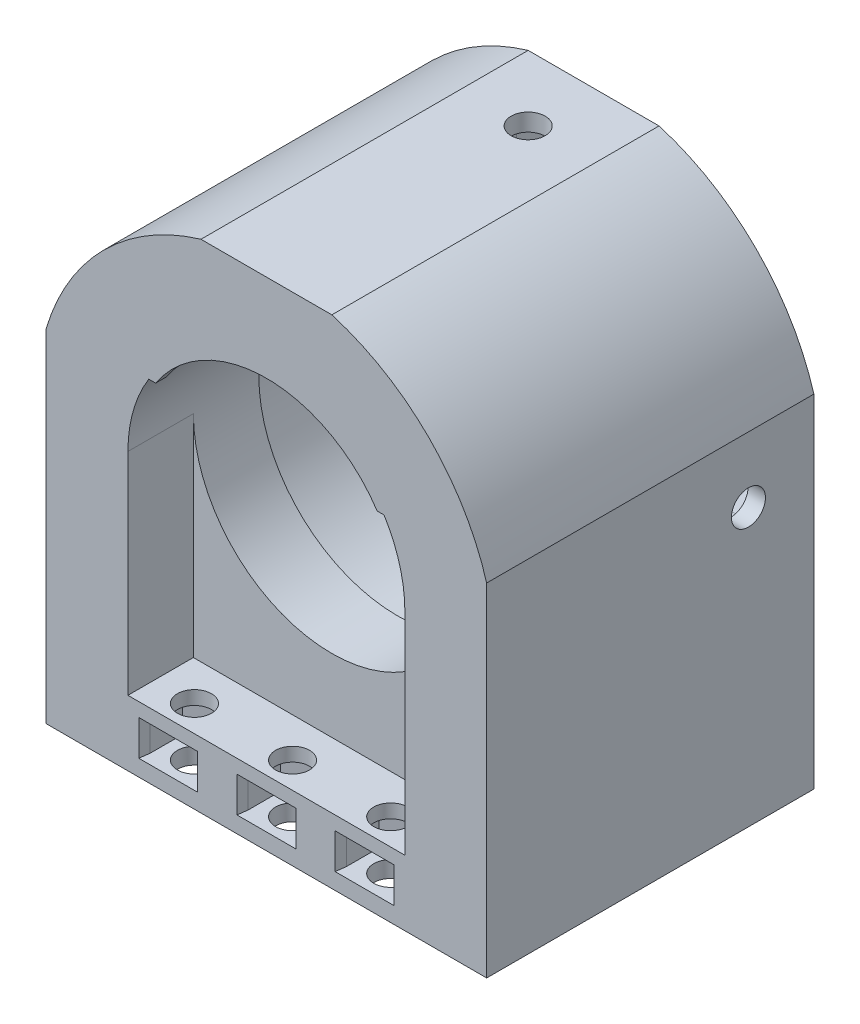
from build123d import *

# Parameters (mm, degrees)
BOSS_EXTRUDE2_DEPTH = 12.7
CUT_EXTRUDE1_DEPTH  = 12.7
CUT_EXTRUDE2_START  = -12.7
CUT_EXTRUDE2_DEPTH  = 12.7
BOSS_EXTRUDE3_REACH = 106.45
SKETCH9_R           = 3.3020000000000005
SKETCH9_R_2         = 3.3019999999999987
CUT_EXTRUDE3_DEPTH  = 93.09259864397356
CUT_EXTRUDE4_START  = -3.175
CUT_EXTRUDE4_DEPTH  = 6.8580000000000005
BOSS_EXTRUDE6_DEPTH = 38.1
SKETCH12_W          = 25.4
SKETCH12_H          = 6.350000000000001
BOSS_EXTRUDE4_DEPTH = 25.4
CUT_EXTRUDE5_START  = 39.370000000000005
CUT_EXTRUDE5_DEPTH  = 6.8580000000000005
SKETCH13_R          = 3.302000000000001
CUT_EXTRUDE6_DEPTH  = 93.09259864397356
CIRPATTERN1_COUNT   = 4
BOSS_EXTRUDE5_START = 38.1
BOSS_EXTRUDE5_DEPTH = 38.1
SKETCH16_W          = 3.1749999999999687
SKETCH16_H          = 40.98999999999984
SKETCH16_W_2        = 3.1750000000001393
SKETCH16_H_2        = 40.990000000000464
BOSS_EXTRUDE7_DEPTH = 63.5
BOSS_EXTRUDE9_START = -63.5
BOSS_EXTRUDE9_DEPTH = 63.5


with BuildPart() as part:
    # Sketch2 → Revolve1 (revolve)
    with BuildSketch(Plane(origin=(0, 0, 0), x_dir=(1, 0, 0), z_dir=(0, 1, 0))):
        Polygon((25.75, 0), (25.75, 2.14), (26.874999999999996, 5.319999999999995), (26.874999999999993, 25.400000000000006), (39.574999999999996, 25.400000000000002), (39.574999999999974, 5.62e-15), align=None)
    revolve(axis=Axis((0, 0, 0), (0, 0, -1)))

    # Sketch3 → Boss-Extrude2 (add)
    with BuildSketch(Plane.XY):
        Polygon((26.87499999999997, 0), (39.574999999999974, 0), (39.57499999999997, -53.690000000000005), (-39.57499999999997, -53.690000000000005), (-39.574999999999974, 0), (-26.874999999999975, 0), (-26.874999999999968, -40.99), (26.874999999999975, -40.99), align=None)
    extrude(amount=-BOSS_EXTRUDE2_DEPTH)

    # Sketch5 → Cut-Extrude1 (cut)
    with BuildSketch(Plane.XY):
        Polygon((26.874999999999975, -40.99), (-26.874999999999968, -40.99000000000001), (-26.874999999999968, -6.94e-15), (26.874999999999975, -7.8e-16), align=None)
    extrude(amount=-CUT_EXTRUDE1_DEPTH, mode=Mode.SUBTRACT)

    # Sketch6 → Cut-Extrude2 (cut)
    with BuildSketch(Plane.XY.offset(CUT_EXTRUDE2_START)):
        with BuildLine():
            Line((-22.832761550018414, 14.174999999999976), (22.832761550018414, 14.174999999999976))
            ThreePointArc((22.832761550018414, 14.174999999999976), (-4.94e-15, -26.874999999999975), (-22.832761550018414, 14.174999999999976))
        make_face()
    extrude(amount=CUT_EXTRUDE2_DEPTH, mode=Mode.SUBTRACT)

    # Sketch7 → Boss-Extrude3 (add, up to next)
    with BuildSketch(Plane.XZ.offset(53.690000000000005), mode=Mode.PRIVATE) as boss_extrude3_sk1:
        Polygon((39.57499999999997, -12.7), (-39.57499999999997, -12.70000000000001), (-39.57499999999997, -25.40000000000001), (39.57499999999997, -25.4), align=None)
    boss_extrude3_tool1 = extrude(boss_extrude3_sk1.sketch, amount=-BOSS_EXTRUDE3_REACH, mode=Mode.PRIVATE) - part.part
    add(boss_extrude3_tool1.solids().sort_by_distance((0, -53.69, -19.05))[0])

    # Sketch8 → Revolve2 (revolve)
    with BuildSketch(Plane(origin=(0, 0, 0), x_dir=(1, 0, 0), z_dir=(0, 1, 0)), mode=Mode.PRIVATE) as revolve2_sk:
        Polygon((-39.574999999999996, 25.400000000000002), (-39.574999999999974, 63.5), (-29.844999999999995, 63.5), (-29.844999999999995, 25.400000000000006), align=None)
    revolve(revolve2_sk.sketch.rotate(Axis((0, 0, -2.42e-15), (0, 0, -1)), 180), axis=Axis((0, 0, -2.42e-15), (0, 0, -1)))

    # Sketch9 → Cut-Extrude3 (cut, through all)
    with BuildSketch(Plane(origin=(0, 0, 0), x_dir=(1, 0, 0), z_dir=(0, 1, 0))):
        with Locations(Location((0, 5.08, 0), (0, 0, 270))):
            Circle(SKETCH9_R)
        with Locations(Location((19.05, 5.080000000000001, 0), (0, 0, 270))):
            Circle(SKETCH9_R_2)
        with Locations(Location((-19.05, 5.08, 0), (0, 0, 270))):
            Circle(SKETCH9_R_2)
    extrude(amount=-CUT_EXTRUDE3_DEPTH, mode=Mode.SUBTRACT)

    # Sketch10 → Cut-Extrude4 (cut)
    with BuildSketch(Plane(origin=(0, -53.690000000000005, 0), x_dir=(-1, 0, 0), z_dir=(0, -1, 0)).offset(CUT_EXTRUDE4_START)):
        Polygon((-24.511, 1.927090179955452), (-24.765, -8.7e-16), (-13.334999999999999, -8.7e-16), (-13.589, 1.927090179955445), (-13.589, 8.232909820044544), (-19.050000000000004, 11.385819640089089), (-24.511, 8.232909820044545), align=None)
        Polygon((1.88e-15, 11.385819640089093), (-5.460999999999999, 8.232909820044547), (-5.461, 1.9270901799554545), (-5.715, 0), (5.715, 0), (5.4609999999999985, 1.9270901799554514), (5.4609999999999985, 8.232909820044547), align=None)
        Polygon((19.049999999999997, 11.385819640089094), (13.589, 8.23290982004455), (13.589, 1.9270901799554547), (13.335, 8.7e-16), (24.765, 8.7e-16), (24.511000000000003, 1.9270901799554534), (24.511, 8.232909820044547), align=None)
    extrude(amount=-CUT_EXTRUDE4_DEPTH, mode=Mode.SUBTRACT)

    # Sketch15 → Boss-Extrude6 (add)
    with BuildSketch(Plane(origin=(0, 0, -25.400000000000006), x_dir=(-1, 0, 0), z_dir=(0, 0, -1))):
        with BuildLine():
            Line((39.57499999999997, -53.690000000000005), (39.574999999999996, 0))
            ThreePointArc((39.574999999999996, 0), (-7.27e-15, -39.574999999999996), (-39.574999999999996, 4.85e-15))
            Line((-39.574999999999996, 4.85e-15), (-39.57499999999997, -53.690000000000005))
            Line((-39.57499999999997, -53.690000000000005), (39.57499999999997, -53.690000000000005))
        make_face()
    extrude(amount=BOSS_EXTRUDE6_DEPTH)

    # Sketch12 → Boss-Extrude4 (add)
    with BuildSketch(Plane(origin=(0, 0, -63.5), x_dir=(-1, 0, 0), z_dir=(0, 0, -1))):
        with Locations((1.155e-14, 39.574999999999974)):
            Rectangle(SKETCH12_W, SKETCH12_H)
    boss_extrude4 = extrude(amount=-BOSS_EXTRUDE4_DEPTH)

    # Sketch11 → Cut-Extrude5 (cut)
    with BuildSketch(Plane(origin=(0, 0, 0), x_dir=(1, 0, 0), z_dir=(0, 1, 0)).offset(CUT_EXTRUDE5_START)):
        Polygon((-6.92e-15, 44.4941803599109), (5.460999999999995, 47.64709017995545), (5.460999999999995, 53.95290982004454), (5.715, 63.5), (-5.715, 63.5), (-5.461000000000004, 53.95290982004454), (-5.461000000000002, 47.64709017995544), align=None)
    cut_extrude5 = extrude(amount=-CUT_EXTRUDE5_DEPTH, mode=Mode.SUBTRACT)

    # Sketch13 → Cut-Extrude6 (cut, through all)
    with BuildSketch(Plane(origin=(0, 0, 0), x_dir=(1, 0, 0), z_dir=(0, 1, 0))):
        with Locations(Location((0, 50.8, 0), (0, 0, 90))):
            Circle(SKETCH13_R)
    cut_extrude6 = extrude(amount=CUT_EXTRUDE6_DEPTH, mode=Mode.SUBTRACT)

    # CirPattern1: Boss-Extrude4, Cut-Extrude5, Cut-Extrude6 ×4 about axis
    cirpattern1_axis = Axis((-1.2e-16, 3e-17, 0), (0, 0, 1))
    add([boss_extrude4.rotate(cirpattern1_axis, i * 360 / CIRPATTERN1_COUNT) for i in range(1, CIRPATTERN1_COUNT)])
    add([cut_extrude5.rotate(cirpattern1_axis, i * 360 / CIRPATTERN1_COUNT) for i in range(1, CIRPATTERN1_COUNT)], mode=Mode.SUBTRACT)
    add([cut_extrude6.rotate(cirpattern1_axis, i * 360 / CIRPATTERN1_COUNT) for i in range(1, CIRPATTERN1_COUNT)], mode=Mode.SUBTRACT)

    # Sketch14 → Boss-Extrude5 (add)
    with BuildSketch(Plane.XY.offset(-38.1).offset(BOSS_EXTRUDE5_START)):
        with BuildLine():
            Line((39.574999999999974, -12.699999999999605), (42.75000000000011, -12.69999999999954))
            Line((42.75000000000011, -12.69999999999954), (42.749999999999844, 12.70000000000046))
            Line((42.749999999999844, 12.70000000000046), (37.48187061767313, 12.7000000000004))
            ThreePointArc((37.48187061767313, 12.7000000000004), (39.048211576808555, 6.435666061317394), (39.57499999999998, 0))
            Line((39.57499999999998, 0), (39.574999999999974, -12.699999999999605))
        make_face()
        with BuildLine():
            Line((12.699999999999985, 37.48187061767327), (12.699999999999987, 42.74999999999998))
            Line((12.699999999999987, 42.74999999999998), (-12.700000000000012, 42.74999999999998))
            Line((-12.700000000000012, 42.74999999999998), (-12.700000000000014, 37.481870617673266))
            ThreePointArc((-12.700000000000014, 37.481870617673266), (-1.515e-14, 39.57499999999998), (12.699999999999985, 37.48187061767327))
        make_face()
        with BuildLine():
            Line((-37.48187061767331, 12.699999999999852), (-42.750000000000014, 12.699999999999838))
            Line((-42.750000000000014, 12.699999999999838), (-42.749999999999936, -12.700000000000161))
            Line((-42.749999999999936, -12.700000000000161), (-39.574999999999974, -12.700000000000161))
            Line((-39.574999999999974, -12.700000000000161), (-39.57499999999998, 4.85e-15))
            ThreePointArc((-39.57499999999998, 4.85e-15), (-39.0482115768086, 6.435666061317119), (-37.48187061767331, 12.699999999999852))
        make_face()
    extrude(amount=-BOSS_EXTRUDE5_DEPTH)

    # Sketch16 → Boss-Extrude7 (add)
    with BuildSketch(Plane(origin=(0, 0, -63.5), x_dir=(-1, 0, 0), z_dir=(0, 0, -1))):
        with Locations((41.16249999999995, -33.195000000000086)):
            Rectangle(SKETCH16_W, SKETCH16_H)
        with Locations((-41.16250000000004, -33.19499999999977)):
            Rectangle(SKETCH16_W_2, SKETCH16_H_2)
    extrude(amount=-BOSS_EXTRUDE7_DEPTH)

    # Sketch17 → Boss-Extrude9 (add)
    with BuildSketch(Plane(origin=(0, 0, -63.5), x_dir=(-1, 0, 0), z_dir=(0, 0, -1)).offset(BOSS_EXTRUDE9_START)):
        with BuildLine():
            Line((-42.749999999999844, 12.70000000000046), (-37.481870617673124, 12.700000000000404))
            ThreePointArc((-37.481870617673124, 12.700000000000404), (-27.98375086545744, 27.983750865457754), (-12.699999999999989, 37.48187061767326))
            Line((-12.699999999999989, 37.48187061767326), (-12.699999999999987, 42.74999999999998))
            ThreePointArc((-12.699999999999987, 42.74999999999998), (-31.53452473084045, 31.534524730840808), (-42.749999999999844, 12.70000000000046))
        make_face()
        with BuildLine():
            Line((37.481870617673124, 12.700000000000404), (42.750000000000014, 12.699999999999838))
            ThreePointArc((42.750000000000014, 12.699999999999838), (31.534524730840676, 31.53452473084055), (12.700000000000012, 42.74999999999998))
            Line((12.700000000000012, 42.74999999999998), (12.700000000000012, 37.48187061767325))
            ThreePointArc((12.700000000000012, 37.48187061767325), (27.98375086545745, 27.983750865457747), (37.481870617673124, 12.700000000000404))
        make_face()
    extrude(amount=BOSS_EXTRUDE9_DEPTH)


solid = part.part
